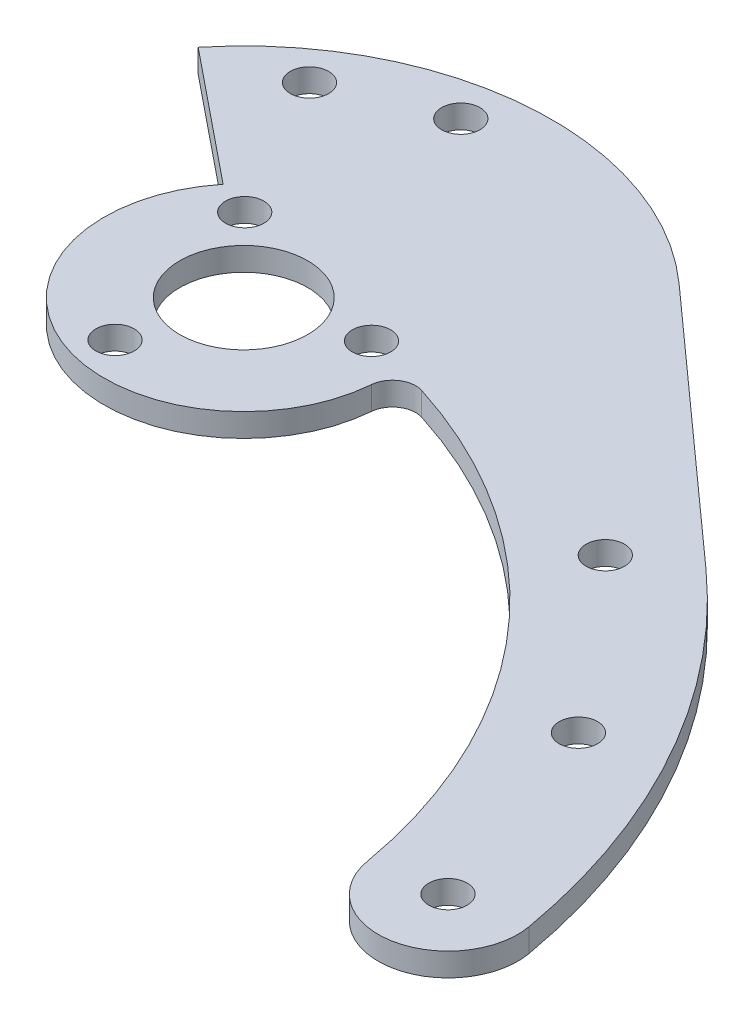
from build123d import *

# Parameters (mm, degrees)
SKETCH_1_R          = 1.65
SKETCH_1_R_2        = 5.5
EXTRUDE_1_DEPTH     = 2
SKETCH_2_R          = 1.65
CUT_EXTRUDE_2_DEPTH = 73.378330115
FILLET_1_R          = 2


with BuildPart() as part:
    # Эскиз1 → Бобышка-Вытянуть1 (new body)
    with BuildSketch(Plane(origin=(0, 0, 0), x_dir=(1, 0, 0), z_dir=(0, 1, 0))):
        with BuildLine():
            Line((-9.325751537, 7.551844693), (-20.594367979, 16.676990363))
            ThreePointArc((-20.594367979, 16.676990363), (-11.408544065, 23.918510035), (0, 26.5))
            ThreePointArc((0, 26.5), (9.472405203, 24.74921291), (17.693175332, 19.728191673))
            Line((17.693175332, 19.728191673), (40.060019619, -0.331452118))
            ThreePointArc((40.060019619, -0.331452118), (52.448537608, -15.858861968), (59.088465181, -34.580165246))
            ThreePointArc((59.088465181, -34.580165246), (54.221507729, -41.53090083), (47.270772145, -36.663943378))
            ThreePointArc((47.270772145, -36.663943378), (35.208034426, -12.373999402), (11.905757948, 1.500975575))
            ThreePointArc((11.905757948, 1.500975575), (-3.288975911, -11.540478216), (-9.325751537, 7.551844693))
        make_face()
        with Locations(Location((-6.322604321, 6.40505071, 0), (0, 0, 270))):
            Circle(SKETCH_1_R, mode=Mode.SUBTRACT)
        with Locations(Location((0, 0, 0), (0, 0, 270))):
            Circle(SKETCH_1_R_2, mode=Mode.SUBTRACT)
        with Locations(Location((8.708238788, 2.273010605, 0), (0, 0, 270))):
            Circle(SKETCH_1_R, mode=Mode.SUBTRACT)
        with Locations(Location((-2.385634467, -8.678061315, 0), (0, 0, 270))):
            Circle(SKETCH_1_R, mode=Mode.SUBTRACT)
    extrude(amount=EXTRUDE_1_DEPTH)

    # Эскиз2 → Вырез-Вытянуть2 (cut, through all)
    with BuildSketch(Plane(origin=(0, 2, 0), x_dir=(1, 0, 0), z_dir=(0, 1, 0))):
        with Locations(Location((-3.993908086, 22.650578319, 0), (0, 0, 270))):
            Circle(SKETCH_2_R)
        with Locations(Location((-13.192258036, 18.840497019, 0), (0, 0, 90))):
            Circle(SKETCH_2_R)
        with Locations(Location((46.765371804, -18, 0), (0, 0, 270))):
            Circle(SKETCH_2_R)
        with Locations(Location((53.179618663, -35.622998406, 0), (0, 0, 270))):
            Circle(SKETCH_2_R)
        with Locations(Location((34.710530923, -3.633600072, 0), (0, 0, 270))):
            Circle(SKETCH_2_R)
    extrude(amount=-CUT_EXTRUDE_2_DEPTH, mode=Mode.SUBTRACT)

    # Скругление1
    fillet_1_edges = [part.edges().sort_by_distance(p)[0] for p in [
        (11.905757948, 1, -1.500975575),
    ]]
    fillet(fillet_1_edges, radius=FILLET_1_R)


solid = part.part
